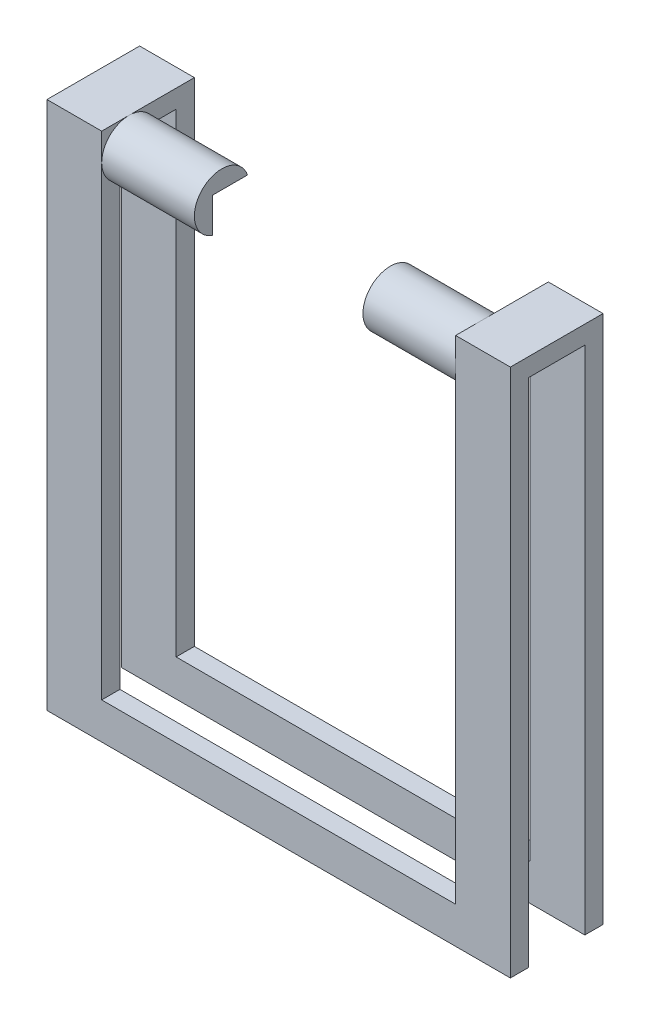
from build123d import *

# Parameters (mm, degrees)
SKETCH1_W               = 25.4
SKETCH1_H               = 5.08
BOSS_EXTRUDE1_DEPTH     = 2
SKETCH2_W               = 3
SKETCH2_H               = 5.08
BOSS_EXTRUDE2_DEPTH     = 27
SKETCH3_R               = 1.5
BOSS_EXTRUDE3_DEPTH     = 5.08
CUT_EXTRUDE1_DEPTH      = 39.634331882
CUT_EXTRUDE1_DEPTH_BACK = 39.634331882
SKETCH4_W               = 3.08
SKETCH4_H               = 28


with BuildPart() as part:
    # Sketch1 → Boss-Extrude1 (new body)
    with BuildSketch(Plane(origin=(0, 0, 0), x_dir=(1, 0, 0), z_dir=(0, 1, 0))):
        Rectangle(SKETCH1_W, SKETCH1_H)
    extrude(amount=BOSS_EXTRUDE1_DEPTH)

    # Sketch2 → Boss-Extrude2 (add)
    with BuildSketch(Plane(origin=(0, 2, 0), x_dir=(1, 0, 0), z_dir=(0, 1, 0))):
        with Locations((11.2, 0)):
            Rectangle(SKETCH2_W, SKETCH2_H)
    boss_extrude2 = extrude(amount=BOSS_EXTRUDE2_DEPTH)

    # Sketch3 → Boss-Extrude3 (add)
    with BuildSketch(Plane.ZY.offset(-9.7)):
        with Locations((1.04, 27.5)):
            Circle(SKETCH3_R)
    boss_extrude3 = extrude(amount=BOSS_EXTRUDE3_DEPTH)

    # Mirror1: Boss-Extrude2, Boss-Extrude3 across plane
    add(boss_extrude2.mirror(Plane(origin=(0, 0, 0), x_dir=(0, 0, 1), z_dir=(1, 0, 0))))
    add(boss_extrude3.mirror(Plane(origin=(0, 0, 0), x_dir=(0, 0, 1), z_dir=(1, 0, 0))))

    # Sketch4 → Cut-Extrude1 (cut, two sides: drawn at the far end of the back side and taken through both)
    with BuildSketch(Plane.ZY.offset(12.7).offset(-CUT_EXTRUDE1_DEPTH_BACK)):
        with Locations((0, 14)):
            Rectangle(SKETCH4_W, SKETCH4_H)
    extrude(amount=CUT_EXTRUDE1_DEPTH + CUT_EXTRUDE1_DEPTH_BACK, mode=Mode.SUBTRACT)


solid = part.part
